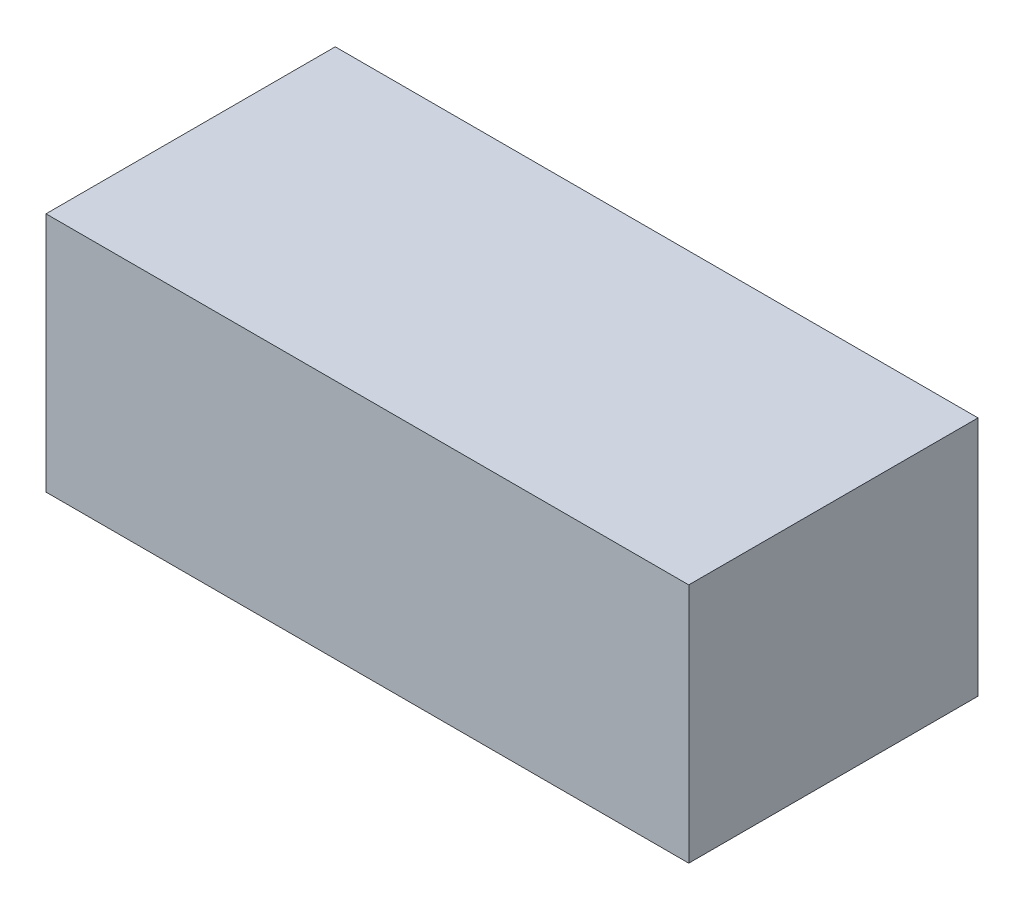
from build123d import *

# Parameters (mm, degrees)
SKETCH1_W           = 200
SKETCH1_H           = 90
BOSS_EXTRUDE1_DEPTH = 75


with BuildPart() as part:
    # Sketch1 → Boss-Extrude1 (new body)
    with BuildSketch(Plane(origin=(0, 0, 0), x_dir=(1, 0, 0), z_dir=(0, 1, 0))):
        with Locations((100, 45)):
            Rectangle(SKETCH1_W, SKETCH1_H)
    extrude(amount=BOSS_EXTRUDE1_DEPTH)


solid = part.part
